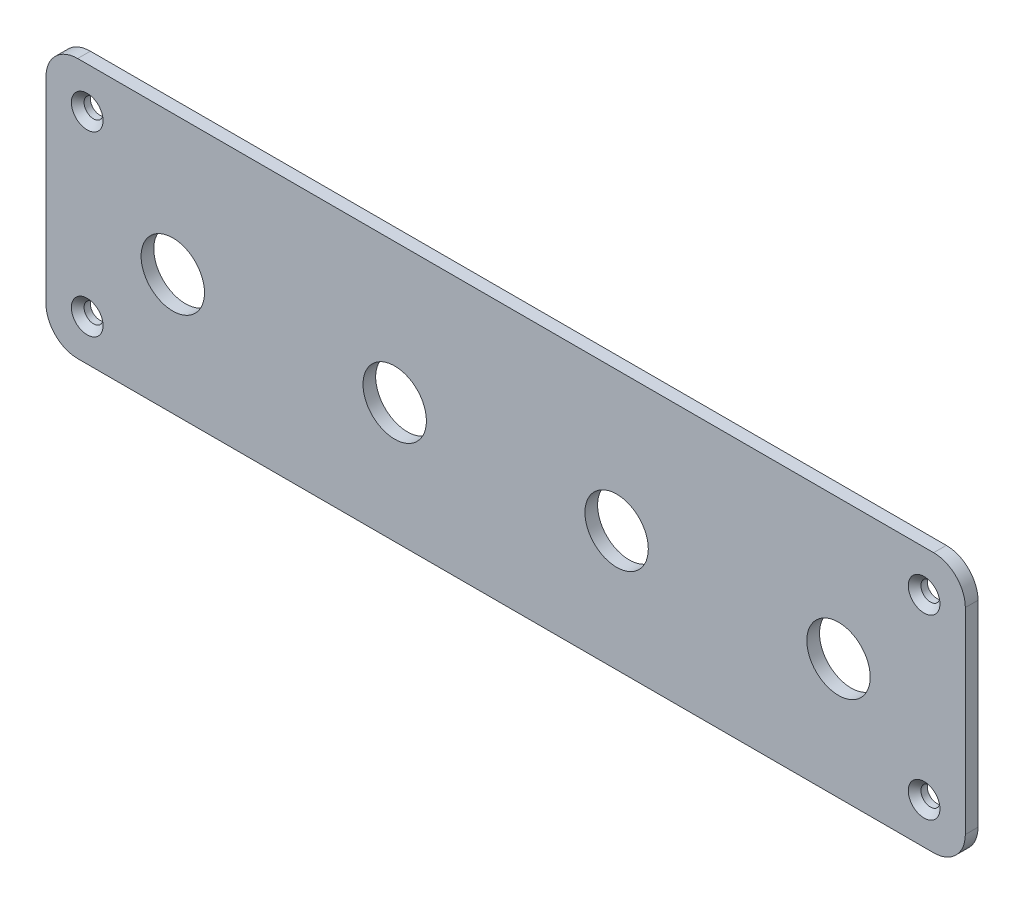
from build123d import *

# Parameters (mm, degrees)
CROQUIS1_R              = 5
CROQUIS1_R_2            = 1.5
SALIENTE_EXTRUIR1_DEPTH = 2
CHAFL_N1_SIZE           = 1


with BuildPart() as part:
    # Croquis1 → Saliente-Extruir1 (new body)
    with BuildSketch(Plane.XY):
        with BuildLine():
            Line((-67.5, -20.5), (67.5, -20.5))
            ThreePointArc((67.5, -20.5), (71.035533906, -19.035533906), (72.5, -15.5))
            Line((72.5, -15.5), (72.5, 15.5))
            ThreePointArc((72.5, 15.5), (71.035533906, 19.035533906), (67.5, 20.5))
            Line((67.5, 20.5), (-67.5, 20.5))
            ThreePointArc((-67.5, 20.5), (-71.035533906, 19.035533906), (-72.5, 15.5))
            Line((-72.5, 15.5), (-72.5, -15.5))
            ThreePointArc((-72.5, -15.5), (-71.035533906, -19.035533906), (-67.5, -20.5))
        make_face()
        with Locations((-52.5, -1.5)):
            Circle(CROQUIS1_R, mode=Mode.SUBTRACT)
        with Locations((-17.5, -1.5)):
            Circle(CROQUIS1_R, mode=Mode.SUBTRACT)
        with Locations((17.5, -1.5)):
            Circle(CROQUIS1_R, mode=Mode.SUBTRACT)
        with Locations((52.5, -1.5)):
            Circle(CROQUIS1_R, mode=Mode.SUBTRACT)
        with Locations((-66, 14)):
            Circle(CROQUIS1_R_2, mode=Mode.SUBTRACT)
        with Locations((-66, -14)):
            Circle(CROQUIS1_R_2, mode=Mode.SUBTRACT)
        with Locations((66, -14)):
            Circle(CROQUIS1_R_2, mode=Mode.SUBTRACT)
        with Locations((66, 14)):
            Circle(CROQUIS1_R_2, mode=Mode.SUBTRACT)
    extrude(amount=-SALIENTE_EXTRUIR1_DEPTH)

    # Chaflán1
    chafl_n1_edges = [part.edges().sort_by_distance(p)[0] for p in [
        (-67.5, 14, 0),
        (-67.5, -14, 0),
        (64.5, -14, 0),
        (64.5, 14, 0),
    ]]
    chamfer(chafl_n1_edges, length=CHAFL_N1_SIZE)


solid = part.part
